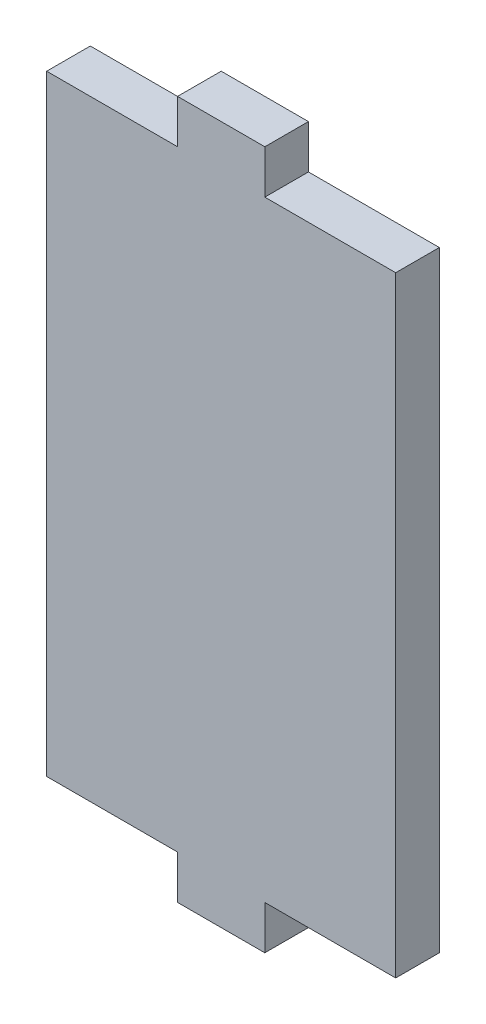
from build123d import *

# Parameters (mm, degrees)
BOSS_EXTRUDE1_DEPTH = 3.175


with BuildPart() as part:
    # Sketch1 → Boss-Extrude1 (new body)
    with BuildSketch(Plane.XY):
        Polygon((-3.175, 0), (3.175, 0), (3.175, 3.175), (12.7, 3.175), (12.7, 47.625), (3.175, 47.625), (3.175, 50.8), (-3.175, 50.8), (-3.175, 47.625), (-12.7, 47.625), (-12.7, 3.175), (-3.175, 3.175), align=None)
    extrude(amount=BOSS_EXTRUDE1_DEPTH)


solid = part.part
